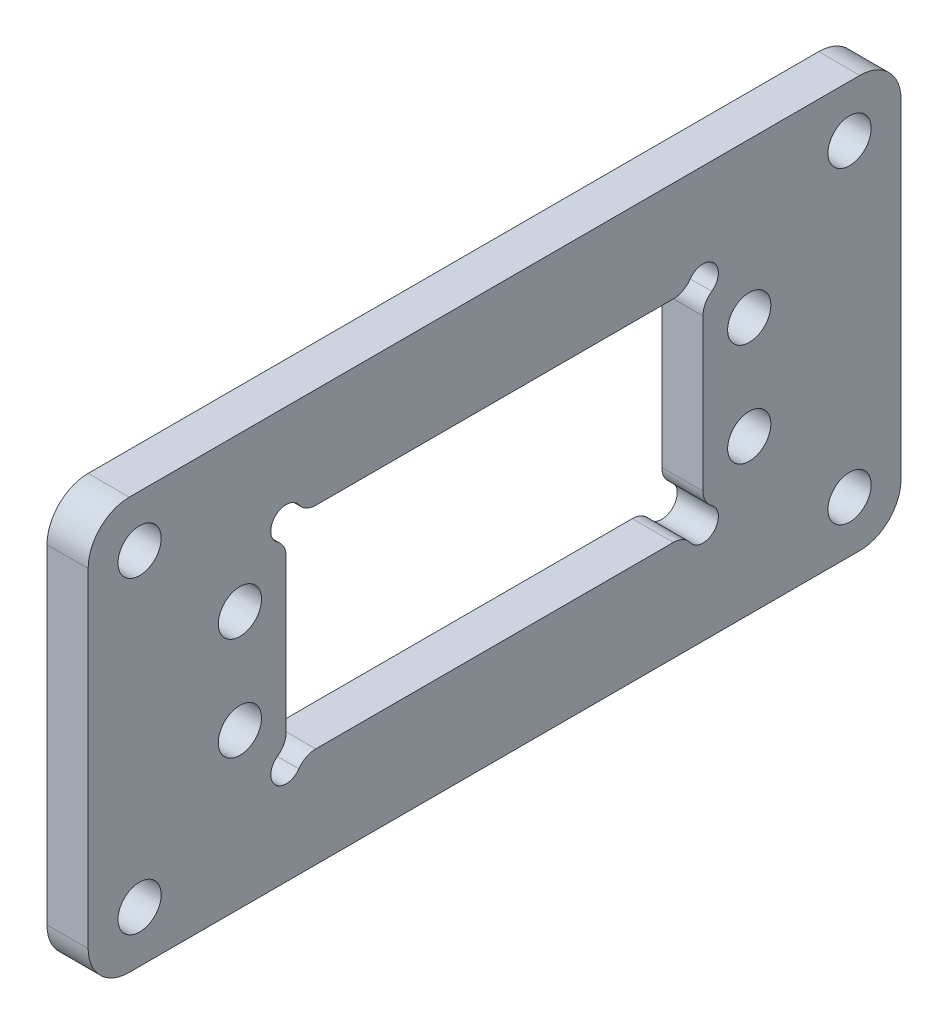
from build123d import *

# Parameters (mm, degrees)
SKETCH_1_W          = 79
SKETCH_1_H          = 40
SKETCH_1_R          = 2.1
SKETCH_1_W_2        = 40.5
SKETCH_1_H_2        = 20.5
EXTRUDE_1_DEPTH     = 4
FILLET_1_R          = 4
SKETCH_2_R          = 1.5
CUT_EXTRUDE_1_DEPTH = 10
FILLET_2_R          = 2


with BuildPart() as part:
    # 草图1 → 凸台-拉伸1 (new body)
    with BuildSketch(Plane(origin=(0, 0, 0), x_dir=(0, 0, -1), z_dir=(1, 0, 0))):
        Rectangle(SKETCH_1_W, SKETCH_1_H)
        with Locations((-34.5, 15)):
            Circle(SKETCH_1_R, mode=Mode.SUBTRACT)
        with Locations((-34.5, -15)):
            Circle(SKETCH_1_R, mode=Mode.SUBTRACT)
        with Locations((-24.75, -5)):
            Circle(SKETCH_1_R, mode=Mode.SUBTRACT)
        with Locations((-24.75, 5)):
            Circle(SKETCH_1_R, mode=Mode.SUBTRACT)
        with Locations((24.75, 5)):
            Circle(SKETCH_1_R, mode=Mode.SUBTRACT)
        with Locations((24.75, -5)):
            Circle(SKETCH_1_R, mode=Mode.SUBTRACT)
        with Locations((34.5, 15)):
            Circle(SKETCH_1_R, mode=Mode.SUBTRACT)
        with Locations((34.5, -15)):
            Circle(SKETCH_1_R, mode=Mode.SUBTRACT)
        Rectangle(SKETCH_1_W_2, SKETCH_1_H_2, mode=Mode.SUBTRACT)
    extrude(amount=EXTRUDE_1_DEPTH)

    # 圆角1
    fillet_1_edges = [part.edges().sort_by_distance(p)[0] for p in [
        (2, -20, -39.5),
        (2, -20, 39.5),
        (2, 20, 39.5),
        (2, 20, -39.5),
    ]]
    fillet(fillet_1_edges, radius=FILLET_1_R)

    # 草图2 → 切除-拉伸1 (cut)
    with BuildSketch(Plane(origin=(4, 0, 0), x_dir=(0, 0, -1), z_dir=(1, 0, 0))):
        with Locations((-20.25, 10.25)):
            Circle(SKETCH_2_R)
        with Locations((-20.25, -10.25)):
            Circle(SKETCH_2_R)
        with Locations((20.25, -10.239026698)):
            Circle(SKETCH_2_R)
        with Locations((20.25, 10.25)):
            Circle(SKETCH_2_R)
    extrude(amount=-CUT_EXTRUDE_1_DEPTH, mode=Mode.SUBTRACT)

    # 圆角2
    fillet_2_edges = [part.edges().sort_by_distance(p)[0] for p in [
        (2, -10.25, 18.75),
        (2, 8.75, -20.25),
        (2, -10.25, -18.750040138),
        (2, -8.75, 20.25),
        (2, 8.75, 20.25),
        (2, 10.25, 18.75),
        (2, 10.25, -18.75),
        (2, -8.739026698, -20.25),
    ]]
    fillet(fillet_2_edges, radius=FILLET_2_R)


solid = part.part
